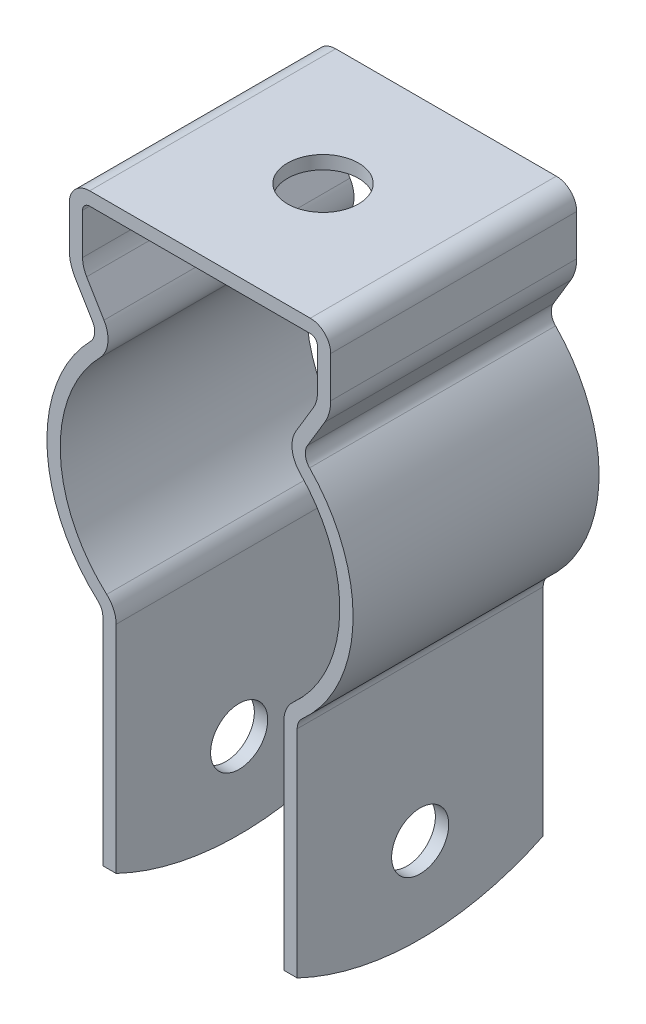
from build123d import *

# Parameters (mm, degrees)
BOSS_EXTRUDE2_DEPTH         = 10.999999971
F_1_4_0_25_DIAMETER_HOLE1_D = 6.35
CUT_EXTRUDE1_DEPTH          = 42.363272981
F_1_4_20_TAPPED_HOLE1_D     = 5.1054


with BuildPart() as part:
    # Sketch2 → Boss-Extrude2 (new, symmetric)
    with BuildSketch(Plane.XY):
        with BuildLine():
            Line((-9.864999955, 19.999999846), (9.864999955, 19.999999846))
            ThreePointArc((9.864999955, 19.999999846), (10.314012761, 19.814012652), (10.499999955, 19.364999846))
            Line((10.499999955, 19.364999846), (10.499999955, 15.703539216))
            ThreePointArc((10.499999955, 15.703539216), (10.407835871, 15.025527914), (10.138031981, 14.396719989))
            Line((10.138031981, 14.396719989), (8.586360945, 11.810601618))
            ThreePointArc((8.586360945, 11.810601618), (8.241569778, 10.208887267), (8.946470225, 8.729872335))
            ThreePointArc((8.946470225, 8.729872335), (12.493042308, -0.417006435), (8.344414884, -9.307026416))
            ThreePointArc((8.344414884, -9.307026416), (7.720691236, -10.162643363), (7.499999986, -11.198214181))
            Line((7.499999986, -11.198214181), (7.499999986, -33.000000008))
            Line((7.499999986, -33.000000008), (8.690624986, -33.000000008))
            Line((8.690624986, -33.000000008), (8.690624986, -11.198214181))
            ThreePointArc((8.690624986, -11.198214181), (8.807867212, -10.648067184), (9.139220401, -10.193520681))
            ThreePointArc((9.139220401, -10.193520681), (13.683004586, -0.456726298), (9.798621513, 9.561392674))
            ThreePointArc((9.798621513, 9.561392674), (9.42414315, 10.347119357), (9.607313458, 11.198030105))
            Line((9.607313458, 11.198030105), (11.158984494, 13.784148477))
            ThreePointArc((11.158984494, 13.784148477), (11.555258957, 14.707710116), (11.690624955, 15.703539216))
            Line((11.690624955, 15.703539216), (11.690624955, 19.364999846))
            ThreePointArc((11.690624955, 19.364999846), (11.155911772, 20.655911664), (9.864999955, 21.190624846))
            Line((9.864999955, 21.190624846), (-9.864999955, 21.190624846))
            ThreePointArc((-9.864999955, 21.190624846), (-11.155911772, 20.655911664), (-11.690624955, 19.364999846))
            Line((-11.690624955, 19.364999846), (-11.690624955, 15.703539216))
            ThreePointArc((-11.690624955, 15.703539216), (-11.555258957, 14.707710116), (-11.158984494, 13.784148477))
            Line((-11.158984494, 13.784148477), (-9.607313458, 11.198030105))
            ThreePointArc((-9.607313458, 11.198030105), (-9.42414315, 10.347119357), (-9.798621513, 9.561392674))
            ThreePointArc((-9.798621513, 9.561392674), (-13.683004586, -0.456726298), (-9.139220401, -10.193520681))
            ThreePointArc((-9.139220401, -10.193520681), (-8.807867212, -10.648067184), (-8.690624986, -11.198214181))
            Line((-8.690624986, -11.198214181), (-8.690624986, -33.000000008))
            Line((-8.690624986, -33.000000008), (-7.499999986, -33.000000008))
            Line((-7.499999986, -33.000000008), (-7.499999986, -11.198214181))
            ThreePointArc((-7.499999986, -11.198214181), (-7.720691236, -10.162643363), (-8.344414884, -9.307026416))
            ThreePointArc((-8.344414884, -9.307026416), (-12.493042308, -0.417006435), (-8.946470225, 8.729872335))
            ThreePointArc((-8.946470225, 8.729872335), (-8.241569778, 10.208887267), (-8.586360945, 11.810601618))
            Line((-8.586360945, 11.810601618), (-10.138031981, 14.396719989))
            ThreePointArc((-10.138031981, 14.396719989), (-10.407835871, 15.025527914), (-10.499999955, 15.703539216))
            Line((-10.499999955, 15.703539216), (-10.499999955, 19.364999846))
            ThreePointArc((-10.499999955, 19.364999846), (-10.314012761, 19.814012652), (-9.864999955, 19.999999846))
        make_face()
    extrude(amount=BOSS_EXTRUDE2_DEPTH, both=True)

    # 1/4 (0.25) Diameter Hole1 (through all)
    with Locations(Plane(origin=(0, 21.190624846, 0), x_dir=(1, 0, 0), z_dir=(0, 1, 0))):
        with Locations((0, 0)):
            Hole(F_1_4_0_25_DIAMETER_HOLE1_D / 2)

    # Sketch6 → Cut-Extrude1 (cut, through all)
    with BuildSketch(Plane(origin=(8.690624986, 0, 0), x_dir=(0, 0, -1), z_dir=(1, 0, 0))):
        with BuildLine():
            Line((-10.999999971, -33.000000008), (0, -33.000000008))
            ThreePointArc((0, -33.000000008), (-5.640257081, -32.367131167), (-10.999999971, -30.499999928))
            Line((-10.999999971, -30.499999928), (-10.999999971, -33.000000008))
        make_face()
        with BuildLine():
            Line((0, -33.000000008), (10.999999971, -33.000000008))
            Line((10.999999971, -33.000000008), (10.999999971, -30.499999928))
            ThreePointArc((10.999999971, -30.499999928), (5.640257081, -32.367131167), (0, -33.000000008))
        make_face()
    extrude(amount=-CUT_EXTRUDE1_DEPTH, mode=Mode.SUBTRACT)

    # 1/4-20 Tapped Hole1 (through all)
    with Locations(Plane(origin=(8.690624986, -25.380000008, 0), x_dir=(0, 1, 0), z_dir=(1, 0, 0))):
        with Locations((0, 0)):
            Hole(F_1_4_20_TAPPED_HOLE1_D / 2)


solid = part.part
